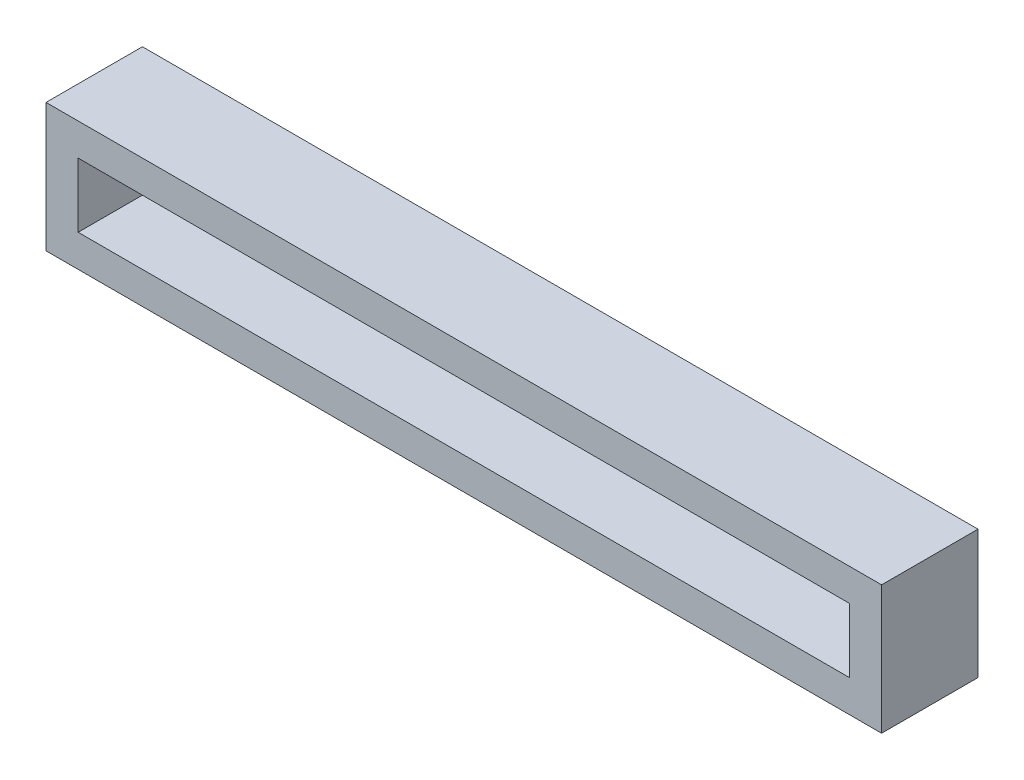
from build123d import *

# Parameters (mm, degrees)
CROQUIS1_W              = 130
CROQUIS1_H              = 20
CROQUIS1_W_2            = 120
CROQUIS1_H_2            = 10
SALIENTE_EXTRUIR1_DEPTH = 15


with BuildPart() as part:
    # Croquis1 → Saliente-Extruir1 (new body)
    with BuildSketch(Plane.XY):
        with Locations((65, 10)):
            Rectangle(CROQUIS1_W, CROQUIS1_H)
        with Locations((65, 10)):
            Rectangle(CROQUIS1_W_2, CROQUIS1_H_2, mode=Mode.SUBTRACT)
    extrude(amount=SALIENTE_EXTRUIR1_DEPTH)


solid = part.part
